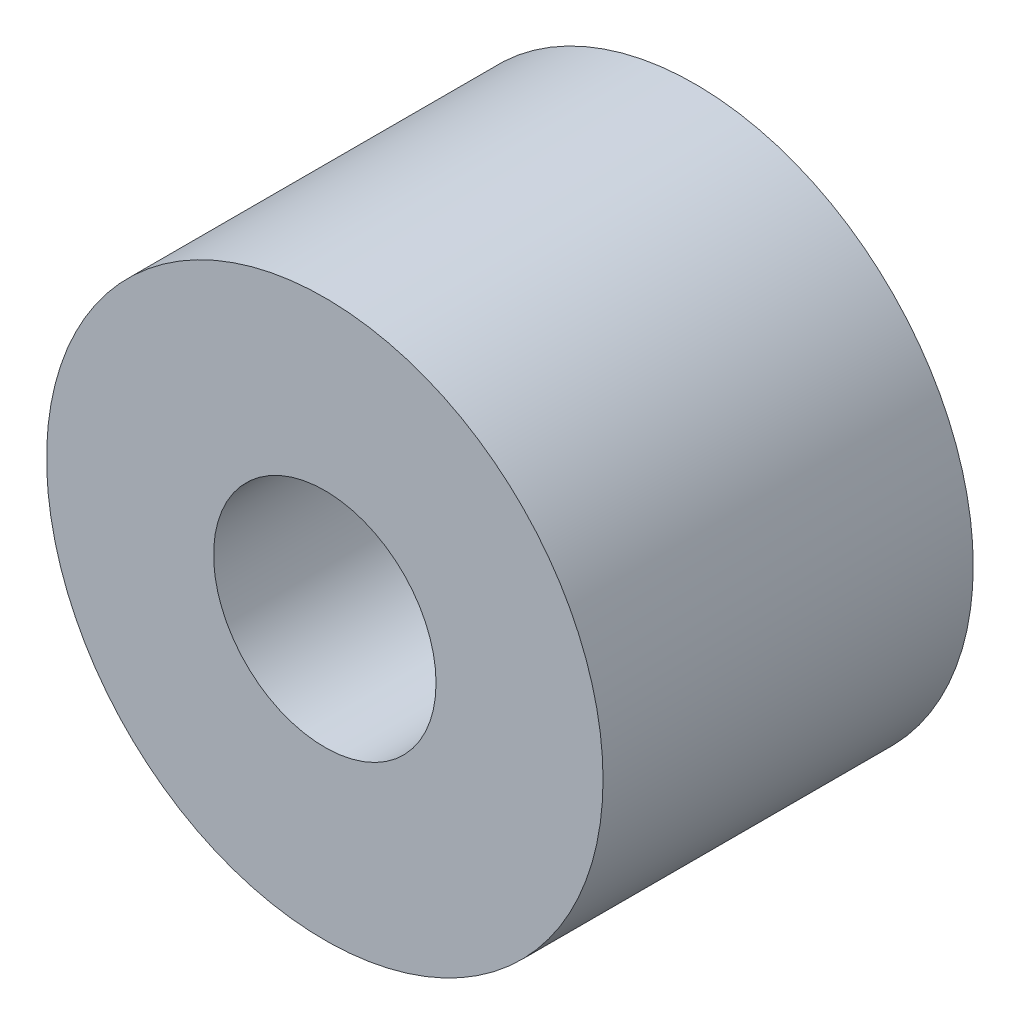
from build123d import *

# Parameters (mm, degrees)
SZKIC1_R                    = 953
SZKIC1_R_2                  = 381
DODANIE_WYCI_GNI_CIE1_DEPTH = 1268


with BuildPart() as part:
    # Szkic1 → Dodanie-wyciągnięcie1 (new body)
    with BuildSketch(Plane.XY):
        Circle(SZKIC1_R)
        Circle(SZKIC1_R_2, mode=Mode.SUBTRACT)
    extrude(amount=DODANIE_WYCI_GNI_CIE1_DEPTH)


solid = part.part
